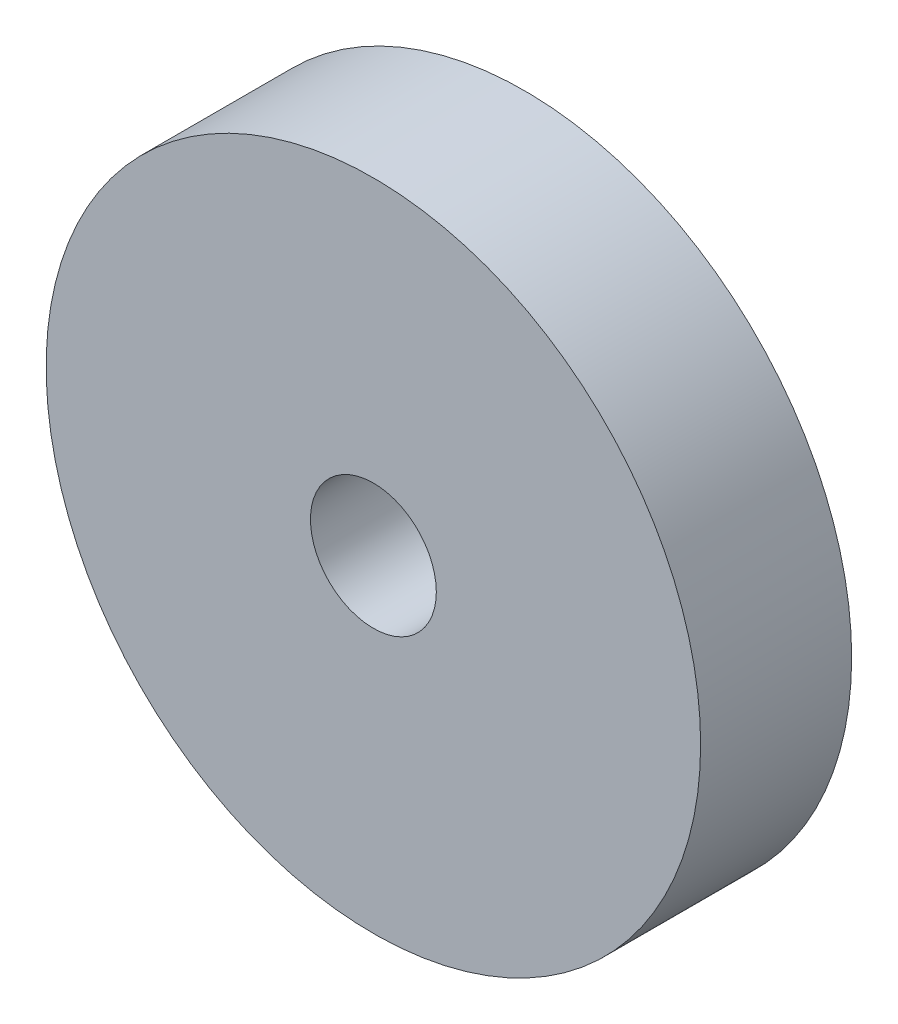
from build123d import *

# Parameters (mm, degrees)
SKETCH_1_R      = 6.5
SKETCH_1_R_2    = 1.25
EXTRUDE_1_DEPTH = 3


with BuildPart() as part:
    # 草图1 → 凸台-拉伸1 (new body)
    with BuildSketch(Plane.XY):
        Circle(SKETCH_1_R)
        Circle(SKETCH_1_R_2, mode=Mode.SUBTRACT)
    extrude(amount=EXTRUDE_1_DEPTH)


solid = part.part
